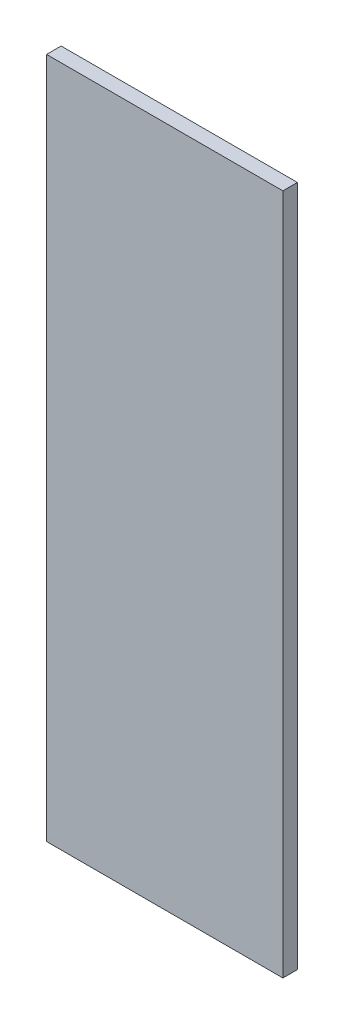
from build123d import *

# Parameters (mm, degrees)
ESQUISSE1_W        = 26
ESQUISSE1_H        = 75
BOSS_EXTRU_1_DEPTH = 1.6


with BuildPart() as part:
    # Esquisse1 → Boss.-Extru.1 (new body)
    with BuildSketch(Plane.XY):
        Rectangle(ESQUISSE1_W, ESQUISSE1_H)
    extrude(amount=BOSS_EXTRU_1_DEPTH)


solid = part.part
